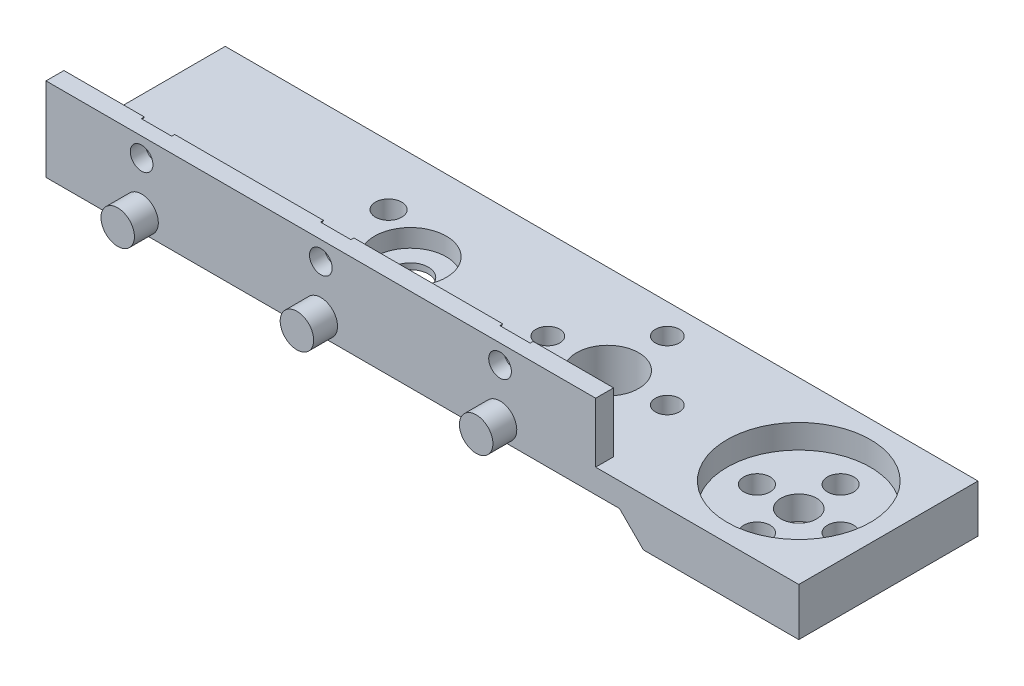
from build123d import *

# Parameters (mm, degrees)
SKETCH_1_W          = 63
SKETCH_1_H          = 15
SKETCH_1_R          = 1.1
SKETCH_1_R_2        = 1
SKETCH_1_R_3        = 1.5
SKETCH_1_R_4        = 2.6
EXTRUDE_1_DEPTH     = 2
EXTRUDE_2_DEPTH     = 2
SKETCH_4_R          = 3
CUT_EXTRUDE_1_DEPTH = 1.5
SKETCH_5_W          = 46
SKETCH_5_H          = 1.5
EXTRUDE_3_DEPTH     = 5
SKETCH_2_3_R        = 0.95
CUT_EXTRUDE_2_DEPTH = 6
CUT_EXTRUDE_START   = -0.25
SKETCH_7_R          = 0.95
CUT_EXTRUDE_3_DEPTH = 0.25
SKETCH_1_3_W        = 15
SKETCH_1_3_H        = 15
SKETCH_1_3_R        = 6
SKETCH_1_3_R_2      = 1.5
SKETCH_1_3_R_3      = 1.1
EXTRUDE_4_DEPTH     = 2
EXTRUDE_START       = -2
SKETCH_1_4_W        = 15
SKETCH_1_4_H        = 15
SKETCH_1_4_R        = 6
SKETCH_1_4_R_2      = 1.5
SKETCH_1_4_R_3      = 1.1
EXTRUDE_5_DEPTH     = 2
SKETCH_1_5_R        = 6
CUT_EXTRUDE_4_DEPTH = 2
CUT_EXTRUDE_5_DEPTH = 15
SKETCH_1_6_R        = 4
SKETCH_1_6_R_2      = 2.6
EXTRUDE_6_DEPTH     = 2


with BuildPart() as part:
    # 草图1 → 凸台-拉伸1 (new body)
    with BuildSketch(Plane(origin=(0, 0, 0), x_dir=(1, 0, 0), z_dir=(0, 1, 0))):
        Rectangle(SKETCH_1_W, SKETCH_1_H)
        with Locations(Location((-4.169872981, -2.5, 0), (0, 0, 270))):
            Circle(SKETCH_1_R, mode=Mode.SUBTRACT)
        with Locations(Location((3, 0, 0), (0, 0, 270))):
            Circle(SKETCH_1_R_2, mode=Mode.SUBTRACT)
        with Locations(Location((13, 0, 0), (0, 0, 270))):
            Circle(SKETCH_1_R_2, mode=Mode.SUBTRACT)
        with Locations(Location((-8.5, 0, 0), (0, 0, 270))):
            Circle(SKETCH_1_R_3, mode=Mode.SUBTRACT)
        with Locations(Location((-12.830127019, 2.5, 0), (0, 0, 270))):
            Circle(SKETCH_1_R, mode=Mode.SUBTRACT)
        with Locations(Location((8, 5, 0), (0, 0, 270))):
            Circle(SKETCH_1_R_2, mode=Mode.SUBTRACT)
        with Locations(Location((8, 0, 0), (0, 0, 270))):
            Circle(SKETCH_1_R_4, mode=Mode.SUBTRACT)
        with Locations(Location((24, 3.5, 0), (0, 0, 270))):
            Circle(SKETCH_1_R, mode=Mode.SUBTRACT)
        with Locations(Location((24, -3.5, 0), (0, 0, 270))):
            Circle(SKETCH_1_R, mode=Mode.SUBTRACT)
        with Locations(Location((20.5, 0, 0), (0, 0, 270))):
            Circle(SKETCH_1_R, mode=Mode.SUBTRACT)
        with Locations(Location((24, 0, 0), (0, 0, 270))):
            Circle(SKETCH_1_R_3, mode=Mode.SUBTRACT)
        with Locations(Location((27.5, 0, 0), (0, 0, 270))):
            Circle(SKETCH_1_R, mode=Mode.SUBTRACT)
    extrude(amount=EXTRUDE_1_DEPTH)

    # 草图2 → 凸台-拉伸2 (add)
    with BuildSketch(Plane.XY.offset(7.5)):
        with BuildLine():
            Line((-22.1, 1.4), (-24.9, 1.4))
            ThreePointArc((-24.9, 1.4), (-23.5, 0), (-22.1, 1.4))
        make_face()
        with BuildLine():
            ThreePointArc((-24.764911064, 2), (-24.865810289, 1.707509764), (-24.9, 1.4))
            Line((-24.9, 1.4), (-22.1, 1.4))
            ThreePointArc((-22.1, 1.4), (-22.134189711, 1.707509764), (-22.235088936, 2))
            Line((-22.235088936, 2), (-24.764911064, 2))
        make_face()
        with BuildLine():
            ThreePointArc((-22.235088936, 2), (-23.5, 2.8), (-24.764911064, 2))
            Line((-24.764911064, 2), (-22.235088936, 2))
        make_face()
        with BuildLine():
            Line((-7.1, 1.4), (-9.9, 1.4))
            ThreePointArc((-9.9, 1.4), (-8.5, 0), (-7.1, 1.4))
        make_face()
        with BuildLine():
            ThreePointArc((-9.764911064, 2), (-9.865810289, 1.707509764), (-9.9, 1.4))
            Line((-9.9, 1.4), (-7.1, 1.4))
            ThreePointArc((-7.1, 1.4), (-7.134189711, 1.707509764), (-7.235088936, 2))
            Line((-7.235088936, 2), (-9.764911064, 2))
        make_face()
        with BuildLine():
            ThreePointArc((-7.235088936, 2), (-8.5, 2.8), (-9.764911064, 2))
            Line((-9.764911064, 2), (-7.235088936, 2))
        make_face()
        with BuildLine():
            Line((7.9, 1.4), (5.1, 1.4))
            ThreePointArc((5.1, 1.4), (6.5, 0), (7.9, 1.4))
        make_face()
        with BuildLine():
            ThreePointArc((5.235088936, 2), (5.134189711, 1.707509764), (5.1, 1.4))
            Line((5.1, 1.4), (7.9, 1.4))
            ThreePointArc((7.9, 1.4), (7.865810289, 1.707509764), (7.764911064, 2))
            Line((7.764911064, 2), (5.235088936, 2))
        make_face()
        with BuildLine():
            ThreePointArc((7.764911064, 2), (6.5, 2.8), (5.235088936, 2))
            Line((5.235088936, 2), (7.764911064, 2))
        make_face()
    extrude(amount=EXTRUDE_2_DEPTH)

    # 草图4 → 切除-拉伸1 (cut)
    with BuildSketch(Plane(origin=(0, 2, 0), x_dir=(1, 0, 0), z_dir=(0, 1, 0))):
        with Locations(Location((-8.5, 0, 0), (0, 0, 270))):
            Circle(SKETCH_4_R)
    extrude(amount=-CUT_EXTRUDE_1_DEPTH, mode=Mode.SUBTRACT)

    # 草图5 → 凸台-拉伸3 (add)
    with BuildSketch(Plane(origin=(0, 2, 0), x_dir=(1, 0, 0), z_dir=(0, 1, 0))):
        with Locations((-8.5, -6.75)):
            Rectangle(SKETCH_5_W, SKETCH_5_H)
    extrude(amount=EXTRUDE_3_DEPTH)

    # 草图2<3> → 切除-拉伸2 (cut)
    with BuildSketch(Plane.XY.offset(7.5)):
        with Locations((-23.5, 5.4)):
            Circle(SKETCH_2_3_R)
        with Locations((-8.5, 5.4)):
            Circle(SKETCH_2_3_R)
        with Locations((6.5, 5.4)):
            Circle(SKETCH_2_3_R)
    extrude(amount=-CUT_EXTRUDE_2_DEPTH, mode=Mode.SUBTRACT)

    # 草图7 → 切除-拉伸3 (cut)
    # profile 1 of 3: a face of its own
    with BuildSketch(Plane(origin=(0, 0, 6), x_dir=(-1, 0, 0), z_dir=(0, 0, -1)).offset(CUT_EXTRUDE_START)):
        Polygon((-7.596965511, 3.5), (-5.403034489, 3.5), (-4.306068977, 5.4), (-5.403034489, 7.3), (-7.596965511, 7.3), (-8.693931023, 5.4), align=None)
        with Locations(Location((-6.5, 5.4, 0), (0, 0, 180))):
            Circle(SKETCH_7_R, mode=Mode.SUBTRACT)
    # profile 2 of 3: a face of its own
    with BuildSketch(Plane(origin=(0, 0, 6), x_dir=(-1, 0, 0), z_dir=(0, 0, -1)).offset(CUT_EXTRUDE_START)):
        Polygon((6.306068977, 5.4), (7.403034489, 3.5), (9.596965511, 3.5), (10.693931023, 5.4), (9.596965511, 7.3), (7.403034489, 7.3), align=None)
        with Locations(Location((8.5, 5.4, 0), (0, 0, 180))):
            Circle(SKETCH_7_R, mode=Mode.SUBTRACT)
    # profile 3 of 3: a face of its own
    with BuildSketch(Plane(origin=(0, 0, 6), x_dir=(-1, 0, 0), z_dir=(0, 0, -1)).offset(CUT_EXTRUDE_START)):
        Polygon((21.306068977, 5.4), (22.403034489, 3.5), (24.596965511, 3.5), (25.693931023, 5.4), (24.596965511, 7.3), (22.403034489, 7.3), align=None)
    extrude(amount=CUT_EXTRUDE_3_DEPTH, mode=Mode.SUBTRACT)

    # 草图1<3> → 凸台-拉伸4 (add)
    # profile 1 of 2: a face of its own
    with BuildSketch(Plane(origin=(0, 0, 0), x_dir=(1, 0, 0), z_dir=(0, 1, 0))):
        with Locations((24, 0)):
            Rectangle(SKETCH_1_3_W, SKETCH_1_3_H)
        with Locations((24, 0)):
            Circle(SKETCH_1_3_R, mode=Mode.SUBTRACT)
    # profile 2 of 2: a face of its own
    with BuildSketch(Plane(origin=(0, 0, 0), x_dir=(1, 0, 0), z_dir=(0, 1, 0))):
        with Locations((24, 0)):
            Circle(SKETCH_1_3_R)
        with Locations(Location((24, 0, 0), (0, 0, 270))):
            Circle(SKETCH_1_3_R_2, mode=Mode.SUBTRACT)
        with Locations(Location((27.5, 0, 0), (0, 0, 270))):
            Circle(SKETCH_1_3_R_3, mode=Mode.SUBTRACT)
        with Locations(Location((24, -3.5, 0), (0, 0, 270))):
            Circle(SKETCH_1_3_R_3, mode=Mode.SUBTRACT)
        with Locations(Location((20.5, 0, 0), (0, 0, 270))):
            Circle(SKETCH_1_3_R_3, mode=Mode.SUBTRACT)
        with Locations(Location((24, 3.5, 0), (0, 0, 270))):
            Circle(SKETCH_1_3_R_3, mode=Mode.SUBTRACT)
    extrude(amount=EXTRUDE_4_DEPTH)

    # 草图1<4> → 凸台-拉伸5 (add)
    # profile 1 of 2: a face of its own
    with BuildSketch(Plane(origin=(0, 0, 0), x_dir=(1, 0, 0), z_dir=(0, 1, 0)).offset(EXTRUDE_START)):
        with Locations((24, 0)):
            Rectangle(SKETCH_1_4_W, SKETCH_1_4_H)
        with Locations((24, 0)):
            Circle(SKETCH_1_4_R, mode=Mode.SUBTRACT)
    # profile 2 of 2: a face of its own
    with BuildSketch(Plane(origin=(0, 0, 0), x_dir=(1, 0, 0), z_dir=(0, 1, 0)).offset(EXTRUDE_START)):
        with Locations((24, 0)):
            Circle(SKETCH_1_4_R)
        with Locations(Location((24, 0, 0), (0, 0, 270))):
            Circle(SKETCH_1_4_R_2, mode=Mode.SUBTRACT)
        with Locations(Location((27.5, 0, 0), (0, 0, 270))):
            Circle(SKETCH_1_4_R_3, mode=Mode.SUBTRACT)
        with Locations(Location((24, -3.5, 0), (0, 0, 270))):
            Circle(SKETCH_1_4_R_3, mode=Mode.SUBTRACT)
        with Locations(Location((20.5, 0, 0), (0, 0, 270))):
            Circle(SKETCH_1_4_R_3, mode=Mode.SUBTRACT)
        with Locations(Location((24, 3.5, 0), (0, 0, 270))):
            Circle(SKETCH_1_4_R_3, mode=Mode.SUBTRACT)
    extrude(amount=EXTRUDE_5_DEPTH)

    # 草图1<5> → 切除-拉伸4 (cut)
    with BuildSketch(Plane(origin=(0, 0, 0), x_dir=(1, 0, 0), z_dir=(0, 1, 0))):
        with Locations(Location((24, 0, 0), (0, 0, 270))):
            Circle(SKETCH_1_5_R)
    extrude(amount=CUT_EXTRUDE_4_DEPTH, mode=Mode.SUBTRACT)

    # 草图8 → 切除-拉伸5 (cut)
    with BuildSketch(Plane(origin=(0, 0, -7.5), x_dir=(-1, 0, 0), z_dir=(0, 0, -1))):
        Polygon((-16.5, 0), (-18.5, -2), (-16.5, -2), align=None)
    extrude(amount=-CUT_EXTRUDE_5_DEPTH, mode=Mode.SUBTRACT)

    # 草图1<6> → 凸台-拉伸6 (add)
    with BuildSketch(Plane(origin=(0, 0, 0), x_dir=(1, 0, 0), z_dir=(0, 1, 0)).offset(EXTRUDE_START)):
        with Locations(Location((8, 0, 0), (0, 0, 270))):
            Circle(SKETCH_1_6_R)
        with Locations(Location((8, 0, 0), (0, 0, 270))):
            Circle(SKETCH_1_6_R_2, mode=Mode.SUBTRACT)
    extrude(amount=EXTRUDE_6_DEPTH)


solid = part.part
